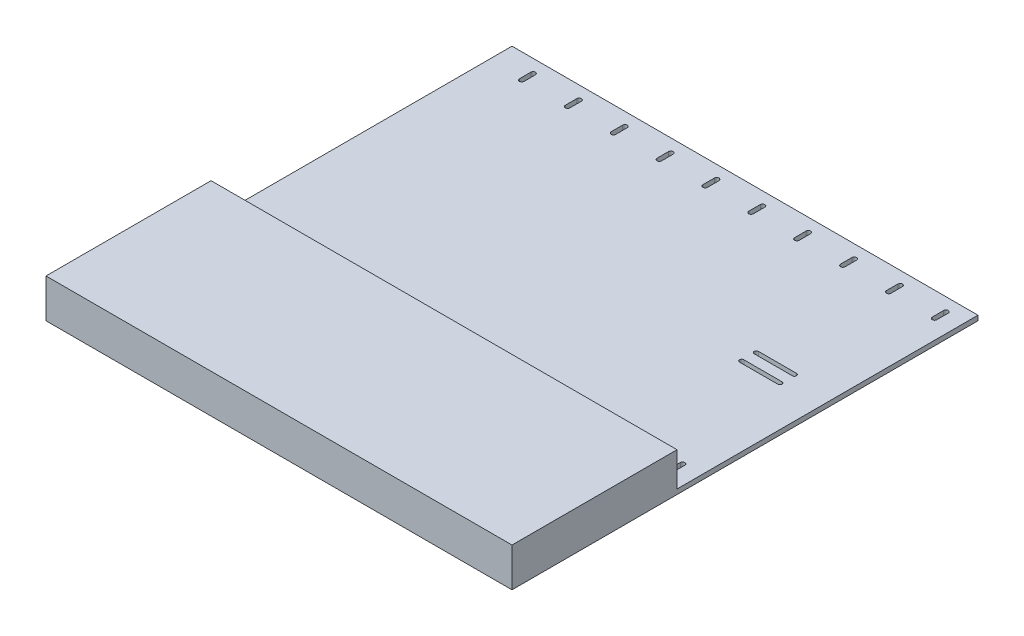
from build123d import *

# Parameters (mm, degrees)
SKETCH1_W           = 609.6
SKETCH1_H           = 393.7
BOSS_EXTRUDE1_DEPTH = 6.35
SKETCH2_W           = 609.6
SKETCH2_H           = 215.9
BOSS_EXTRUDE2_DEPTH = 50.8


with BuildPart() as part:
    # Sketch1 → Boss-Extrude1 (new body)
    with BuildSketch(Plane(origin=(0, 0, 0), x_dir=(1, 0, 0), z_dir=(0, 1, 0))):
        with Locations((304.8, 196.85)):
            Rectangle(SKETCH1_W, SKETCH1_H)
        with BuildLine():
            Line((587.8, 32.05), (587.8, 17.05))
            ThreePointArc((587.8, 17.05), (584.8, 14.05), (581.8, 17.05))
            Line((581.8, 17.05), (581.8, 32.05))
            ThreePointArc((581.8, 32.05), (584.8, 35.05), (587.8, 32.05))
        make_face(mode=Mode.SUBTRACT)
        with BuildLine():
            Line((527.8, 32.05), (527.8, 17.05))
            ThreePointArc((527.8, 17.05), (524.8, 14.05), (521.8, 17.05))
            Line((521.8, 17.05), (521.8, 32.05))
            ThreePointArc((521.8, 32.05), (524.8, 35.05), (527.8, 32.05))
        make_face(mode=Mode.SUBTRACT)
        with BuildLine():
            Line((467.8, 32.05), (467.8, 17.05))
            ThreePointArc((467.8, 17.05), (464.8, 14.05), (461.8, 17.05))
            Line((461.8, 17.05), (461.8, 32.05))
            ThreePointArc((461.8, 32.05), (464.8, 35.05), (467.8, 32.05))
        make_face(mode=Mode.SUBTRACT)
        with BuildLine():
            Line((407.8, 32.05), (407.8, 17.05))
            ThreePointArc((407.8, 17.05), (404.8, 14.05), (401.8, 17.05))
            Line((401.8, 17.05), (401.8, 32.05))
            ThreePointArc((401.8, 32.05), (404.8, 35.05), (407.8, 32.05))
        make_face(mode=Mode.SUBTRACT)
        with BuildLine():
            Line((347.8, 32.05), (347.8, 17.05))
            ThreePointArc((347.8, 17.05), (344.8, 14.05), (341.8, 17.05))
            Line((341.8, 17.05), (341.8, 32.05))
            ThreePointArc((341.8, 32.05), (344.8, 35.05), (347.8, 32.05))
        make_face(mode=Mode.SUBTRACT)
        with BuildLine():
            Line((287.8, 32.05), (287.8, 17.05))
            ThreePointArc((287.8, 17.05), (284.8, 14.05), (281.8, 17.05))
            Line((281.8, 17.05), (281.8, 32.05))
            ThreePointArc((281.8, 32.05), (284.8, 35.05), (287.8, 32.05))
        make_face(mode=Mode.SUBTRACT)
        with BuildLine():
            Line((227.8, 32.05), (227.8, 17.05))
            ThreePointArc((227.8, 17.05), (224.8, 14.05), (221.8, 17.05))
            Line((221.8, 17.05), (221.8, 32.05))
            ThreePointArc((221.8, 32.05), (224.8, 35.05), (227.8, 32.05))
        make_face(mode=Mode.SUBTRACT)
        with BuildLine():
            Line((167.8, 32.05), (167.8, 17.05))
            ThreePointArc((167.8, 17.05), (164.8, 14.05), (161.8, 17.05))
            Line((161.8, 17.05), (161.8, 32.05))
            ThreePointArc((161.8, 32.05), (164.8, 35.05), (167.8, 32.05))
        make_face(mode=Mode.SUBTRACT)
        with BuildLine():
            Line((107.8, 32.05), (107.8, 17.05))
            ThreePointArc((107.8, 17.05), (104.8, 14.05), (101.8, 17.05))
            Line((101.8, 17.05), (101.8, 32.05))
            ThreePointArc((101.8, 32.05), (104.8, 35.05), (107.8, 32.05))
        make_face(mode=Mode.SUBTRACT)
        with BuildLine():
            Line((47.8, 32.05), (47.8, 17.05))
            ThreePointArc((47.8, 17.05), (44.8, 14.05), (41.8, 17.05))
            Line((41.8, 17.05), (41.8, 32.05))
            ThreePointArc((41.8, 32.05), (44.8, 35.05), (47.8, 32.05))
        make_face(mode=Mode.SUBTRACT)
        with BuildLine():
            Line((527.8, 376.65), (527.8, 361.65))
            ThreePointArc((527.8, 361.65), (524.8, 358.65), (521.8, 361.65))
            Line((521.8, 361.65), (521.8, 376.65))
            ThreePointArc((521.8, 376.65), (524.8, 379.65), (527.8, 376.65))
        make_face(mode=Mode.SUBTRACT)
        with BuildLine():
            Line((467.8, 376.65), (467.8, 361.65))
            ThreePointArc((467.8, 361.65), (464.8, 358.65), (461.8, 361.65))
            Line((461.8, 361.65), (461.8, 376.65))
            ThreePointArc((461.8, 376.65), (464.8, 379.65), (467.8, 376.65))
        make_face(mode=Mode.SUBTRACT)
        with BuildLine():
            Line((407.8, 376.65), (407.8, 361.65))
            ThreePointArc((407.8, 361.65), (404.8, 358.65), (401.8, 361.65))
            Line((401.8, 361.65), (401.8, 376.65))
            ThreePointArc((401.8, 376.65), (404.8, 379.65), (407.8, 376.65))
        make_face(mode=Mode.SUBTRACT)
        with BuildLine():
            Line((347.8, 376.65), (347.8, 361.65))
            ThreePointArc((347.8, 361.65), (344.8, 358.65), (341.8, 361.65))
            Line((341.8, 361.65), (341.8, 376.65))
            ThreePointArc((341.8, 376.65), (344.8, 379.65), (347.8, 376.65))
        make_face(mode=Mode.SUBTRACT)
        with BuildLine():
            Line((287.8, 376.65), (287.8, 361.65))
            ThreePointArc((287.8, 361.65), (284.8, 358.65), (281.8, 361.65))
            Line((281.8, 361.65), (281.8, 376.65))
            ThreePointArc((281.8, 376.65), (284.8, 379.65), (287.8, 376.65))
        make_face(mode=Mode.SUBTRACT)
        with BuildLine():
            Line((227.8, 376.65), (227.8, 361.65))
            ThreePointArc((227.8, 361.65), (224.8, 358.65), (221.8, 361.65))
            Line((221.8, 361.65), (221.8, 376.65))
            ThreePointArc((221.8, 376.65), (224.8, 379.65), (227.8, 376.65))
        make_face(mode=Mode.SUBTRACT)
        with BuildLine():
            Line((167.8, 376.65), (167.8, 361.65))
            ThreePointArc((167.8, 361.65), (164.8, 358.65), (161.8, 361.65))
            Line((161.8, 361.65), (161.8, 376.65))
            ThreePointArc((161.8, 376.65), (164.8, 379.65), (167.8, 376.65))
        make_face(mode=Mode.SUBTRACT)
        with BuildLine():
            Line((107.8, 376.65), (107.8, 361.65))
            ThreePointArc((107.8, 361.65), (104.8, 358.65), (101.8, 361.65))
            Line((101.8, 361.65), (101.8, 376.65))
            ThreePointArc((101.8, 376.65), (104.8, 379.65), (107.8, 376.65))
        make_face(mode=Mode.SUBTRACT)
        with BuildLine():
            Line((47.8, 376.65), (47.8, 361.65))
            ThreePointArc((47.8, 361.65), (44.8, 358.65), (41.8, 361.65))
            Line((41.8, 361.65), (41.8, 376.65))
            ThreePointArc((41.8, 376.65), (44.8, 379.65), (47.8, 376.65))
        make_face(mode=Mode.SUBTRACT)
        with BuildLine():
            Line((587.8, 376.65), (587.8, 361.65))
            ThreePointArc((587.8, 361.65), (584.8, 358.65), (581.8, 361.65))
            Line((581.8, 361.65), (581.8, 376.65))
            ThreePointArc((581.8, 376.65), (584.8, 379.65), (587.8, 376.65))
        make_face(mode=Mode.SUBTRACT)
        with BuildLine():
            Line((506.85, 209.125), (556.85, 209.125))
            ThreePointArc((556.85, 209.125), (559.6, 206.375), (556.85, 203.625))
            Line((556.85, 203.625), (506.85, 203.625))
            ThreePointArc((506.85, 203.625), (504.1, 206.375), (506.85, 209.125))
        make_face(mode=Mode.SUBTRACT)
        with BuildLine():
            Line((506.85, 190.075), (556.85, 190.075))
            ThreePointArc((556.85, 190.075), (559.6, 187.325), (556.85, 184.575))
            Line((556.85, 184.575), (506.85, 184.575))
            ThreePointArc((506.85, 184.575), (504.1, 187.325), (506.85, 190.075))
        make_face(mode=Mode.SUBTRACT)
    extrude(amount=BOSS_EXTRUDE1_DEPTH)

    # Sketch2 → Boss-Extrude2 (add)
    with BuildSketch(Plane.XZ):
        with Locations((304.8, 107.95)):
            Rectangle(SKETCH2_W, SKETCH2_H)
    extrude(amount=-BOSS_EXTRUDE2_DEPTH)


solid = part.part
